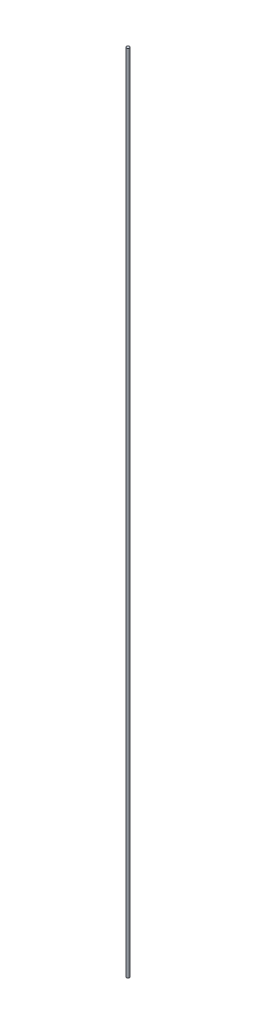
from build123d import *

# Parameters (mm, degrees)
SKETCH1_R           = 12.7
BOSS_EXTRUDE3_DEPTH = 6852.53646


with BuildPart() as part:
    # Sketch1 → Boss-Extrude3 (new body)
    with BuildSketch(Plane(origin=(0, 0, 0), x_dir=(1, 0, 0), z_dir=(0, 1, 0))):
        with Locations(Location((0, 0, 0), (0, 0, 90))):
            Circle(SKETCH1_R)
    extrude(amount=BOSS_EXTRUDE3_DEPTH)


solid = part.part
